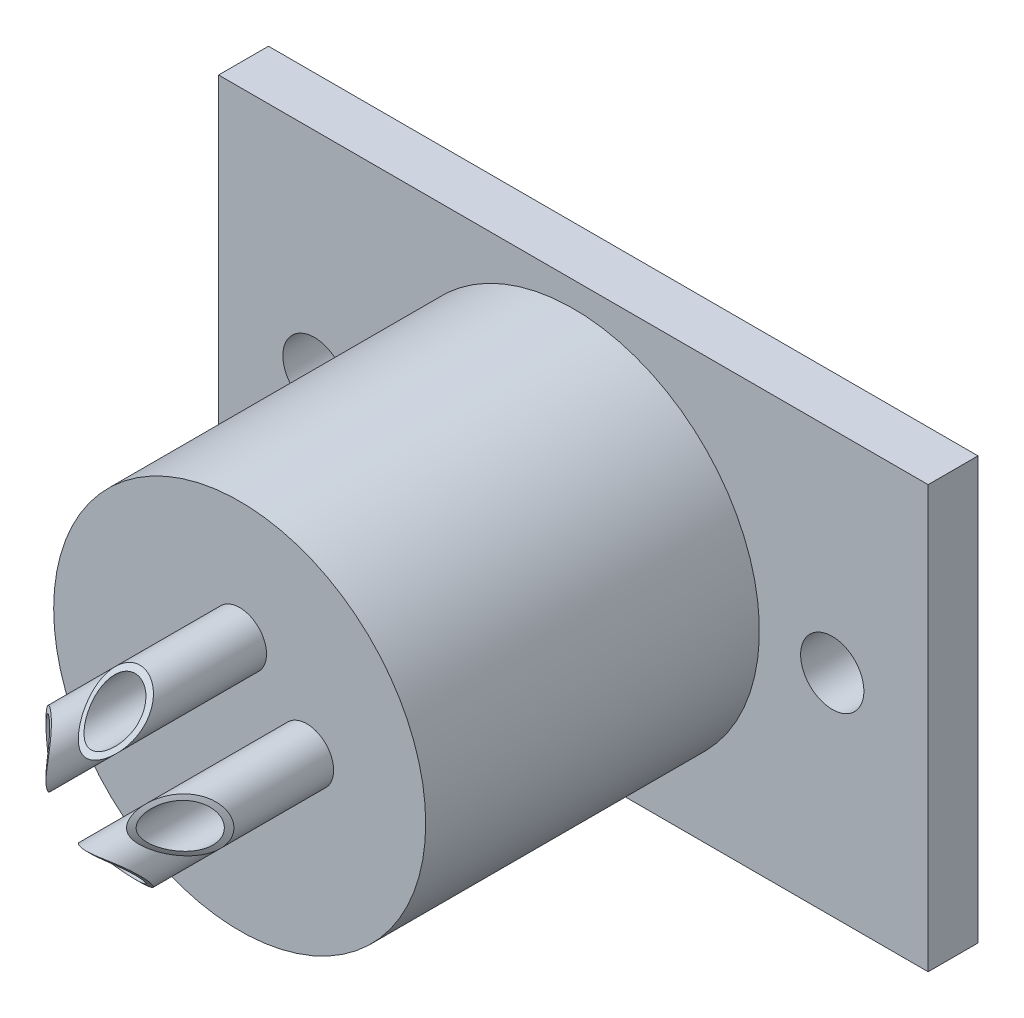
from build123d import *

# Parameters (mm, degrees)
SKETCH1_W           = 37
SKETCH1_H           = 22
BOSS_EXTRUDE1_DEPTH = 2.6
SKETCH2_R           = 9.7
BOSS_EXTRUDE2_DEPTH = 17.4
BOSS_EXTRUDE3_REACH = 31.381
SKETCH3_R           = 1.4
BOSS_EXTRUDE4_REACH = 31.381
SKETCH4_R           = 1.4
BOSS_EXTRUDE5_REACH = 31.381
SKETCH5_R           = 1.4
BOSS_EXTRUDE6_REACH = 31.381
SKETCH6_R           = 1.4
HOLE1_D             = 16
HOLE1_DEPTH         = 15
BOSS_EXTRUDE7_START = 15
SKETCH9_R           = 1.4
BOSS_EXTRUDE7_DEPTH = 15
BOSS_EXTRUDE8_START = 15
SKETCH10_R          = 1.4
BOSS_EXTRUDE8_DEPTH = 15
BOSS_EXTRUDE9_START = 15
SKETCH11_R          = 1.4
BOSS_EXTRUDE9_DEPTH = 15
HOLE2_D             = 3.3
HOLE3_D             = 3.3
HOLE4_D             = 2.3
HOLE4_DEPTH         = 7.75
HOLE5_D             = 2.3
HOLE5_DEPTH         = 7.75
HOLE6_D             = 2.3
HOLE6_DEPTH         = 7.75
HOLE7_D             = 2.3
HOLE7_DEPTH         = 7.75


with BuildPart() as part:
    # Sketch1 → Boss-Extrude1 (new body)
    with BuildSketch(Plane(origin=(0, 0, 0), x_dir=(-1, 0, 0), z_dir=(0, 0, -1))):
        Rectangle(SKETCH1_W, SKETCH1_H)
    extrude(amount=-BOSS_EXTRUDE1_DEPTH)

    # Sketch2 → Boss-Extrude2 (add)
    with BuildSketch(Plane.XY.offset(2.6)):
        with Locations(Location((0, 0, 0), (0, 0, 180))):
            Circle(SKETCH2_R)
    extrude(amount=BOSS_EXTRUDE2_DEPTH)

    # Boss-Extrude3: up to this cone (the profile starts inside it)
    boss_extrude3_end = Plane(origin=(0, 0, 20), z_dir=(0, 0, -1)).offset(-10.099999) * Cone(1e-06, 52.081, 52.080999, align=(Align.CENTER, Align.CENTER, Align.MIN), mode=Mode.PRIVATE)
    # Sketch3 → Boss-Extrude3 (add, up to the surface)
    with BuildSketch(Plane.XY.offset(20), mode=Mode.PRIVATE) as boss_extrude3_sk1:
        with Locations(Location((0, -3.5, 0), (0, 0, 224.197048828))):
            Circle(SKETCH3_R)
    boss_extrude3_tool1 = extrude(boss_extrude3_sk1.sketch, amount=BOSS_EXTRUDE3_REACH, mode=Mode.PRIVATE) & boss_extrude3_end
    add(boss_extrude3_tool1.solids().sort_by_distance((0, -3.5, 20))[0])

    # Boss-Extrude4: up to this cone (the profile starts inside it)
    boss_extrude4_end = Plane(origin=(0, 0, 20), z_dir=(0, 0, -1)).offset(-10.099999) * Cone(1e-06, 52.081, 52.080999, align=(Align.CENTER, Align.CENTER, Align.MIN), mode=Mode.PRIVATE)
    # Sketch4 → Boss-Extrude4 (add, up to the surface)
    with BuildSketch(Plane.XY.offset(20), mode=Mode.PRIVATE) as boss_extrude4_sk1:
        with Locations(Location((-3.5, 0, 0), (0, 0, 225.802951172))):
            Circle(SKETCH4_R)
    boss_extrude4_tool1 = extrude(boss_extrude4_sk1.sketch, amount=BOSS_EXTRUDE4_REACH, mode=Mode.PRIVATE) & boss_extrude4_end
    add(boss_extrude4_tool1.solids().sort_by_distance((-3.5, 0, 20))[0])

    # Boss-Extrude5: up to this cone (the profile starts inside it)
    boss_extrude5_end = Plane(origin=(0, 0, 20), z_dir=(0, 0, -1)).offset(-10.099999) * Cone(1e-06, 52.081, 52.080999, align=(Align.CENTER, Align.CENTER, Align.MIN), mode=Mode.PRIVATE)
    # Sketch5 → Boss-Extrude5 (add, up to the surface)
    with BuildSketch(Plane.XY.offset(20), mode=Mode.PRIVATE) as boss_extrude5_sk1:
        with Locations(Location((3.5, 0, 0), (0, 0, 262.272223238))):
            Circle(SKETCH5_R)
    boss_extrude5_tool1 = extrude(boss_extrude5_sk1.sketch, amount=BOSS_EXTRUDE5_REACH, mode=Mode.PRIVATE) & boss_extrude5_end
    add(boss_extrude5_tool1.solids().sort_by_distance((3.5, 0, 20))[0])

    # Boss-Extrude6: up to this cone (the profile starts inside it)
    boss_extrude6_end = Plane(origin=(0, 0, 20), z_dir=(0, 0, -1)).offset(-10.099999) * Cone(1e-06, 52.081, 52.080999, align=(Align.CENTER, Align.CENTER, Align.MIN), mode=Mode.PRIVATE)
    # Sketch6 → Boss-Extrude6 (add, up to the surface)
    with BuildSketch(Plane.XY.offset(20), mode=Mode.PRIVATE) as boss_extrude6_sk1:
        with Locations(Location((0, 3.5, 0), (0, 0, 187.727776762))):
            Circle(SKETCH6_R)
    boss_extrude6_tool1 = extrude(boss_extrude6_sk1.sketch, amount=BOSS_EXTRUDE6_REACH, mode=Mode.PRIVATE) & boss_extrude6_end
    add(boss_extrude6_tool1.solids().sort_by_distance((0, 3.5, 20))[0])

    # Hole1
    with Locations(Plane(origin=(0, 0, 0), x_dir=(-1, 0, 0), z_dir=(0, 0, -1))):
        with Locations((0, 0)):
            Hole(HOLE1_D / 2, depth=HOLE1_DEPTH)

    # Sketch9 → Boss-Extrude7 (add)
    with BuildSketch(Plane(origin=(0, 0, 15), x_dir=(-1, 0, 0), z_dir=(0, 0, -1)).offset(BOSS_EXTRUDE7_START)):
        with Locations(Location((0, -3.5, 0), (0, 0, 315.802951172))):
            Circle(SKETCH9_R)
    extrude(amount=-BOSS_EXTRUDE7_DEPTH)

    # Sketch10 → Boss-Extrude8 (add)
    with BuildSketch(Plane(origin=(0, 0, 15), x_dir=(-1, 0, 0), z_dir=(0, 0, -1)).offset(BOSS_EXTRUDE8_START)):
        with Locations(Location((3.5, 0, 0), (0, 0, 314.197048828))):
            Circle(SKETCH10_R)
    extrude(amount=-BOSS_EXTRUDE8_DEPTH)

    # Sketch11 → Boss-Extrude9 (add)
    with BuildSketch(Plane(origin=(0, 0, 15), x_dir=(-1, 0, 0), z_dir=(0, 0, -1)).offset(BOSS_EXTRUDE9_START)):
        with Locations(Location((-3.5, 0, 0), (0, 0, 277.727776762))):
            Circle(SKETCH11_R)
    extrude(amount=-BOSS_EXTRUDE9_DEPTH)

    # Hole2 (through all)
    with Locations(Plane.XY.offset(2.6)):
        with Locations((-13.5, 0)):
            Hole(HOLE2_D / 2)

    # Hole3 (through all)
    with Locations(Plane.XY.offset(2.6)):
        with Locations((13.5, 0)):
            Hole(HOLE3_D / 2)

    # Hole4
    with Locations(Plane.XY.offset(27.75)):
        with Locations((0, 3.5)):
            Hole(HOLE4_D / 2, depth=HOLE4_DEPTH)

    # Hole5
    with Locations(Plane.XY.offset(27.75)):
        with Locations((3.5, 0)):
            Hole(HOLE5_D / 2, depth=HOLE5_DEPTH)

    # Hole6
    with Locations(Plane.XY.offset(27.75)):
        with Locations((-3.5, 0)):
            Hole(HOLE6_D / 2, depth=HOLE6_DEPTH)

    # Hole7
    with Locations(Plane.XY.offset(27.75)):
        with Locations((0, -3.5)):
            Hole(HOLE7_D / 2, depth=HOLE7_DEPTH)


solid = part.part
